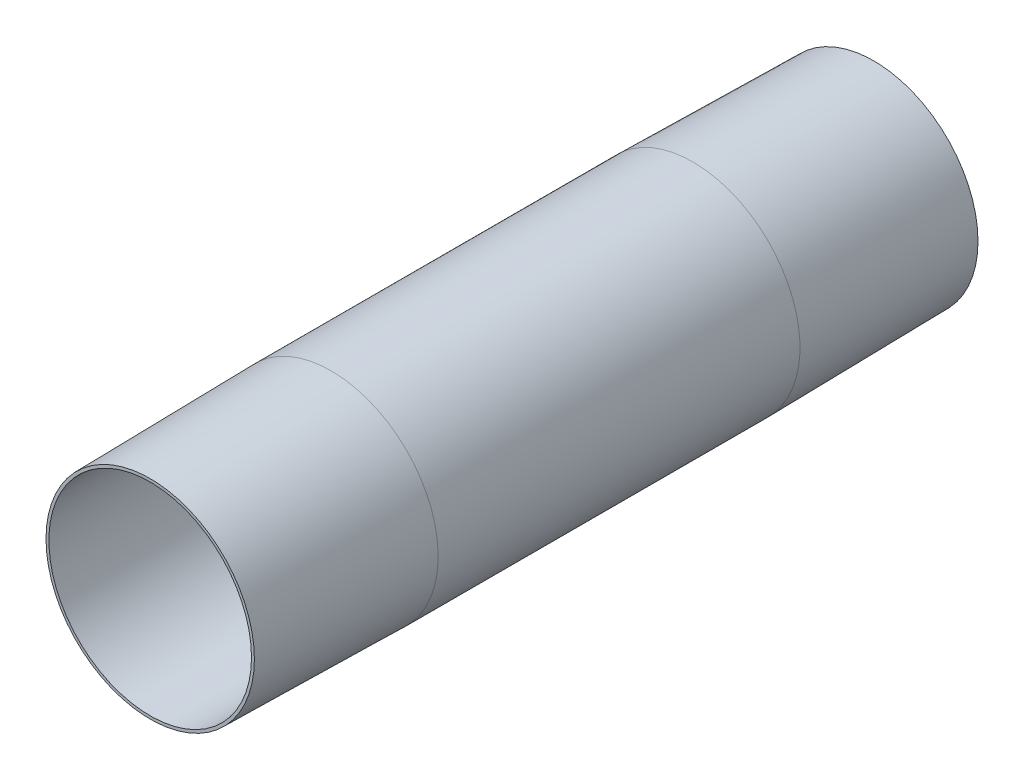
from build123d import *

# Parameters (mm, degrees)
IZIM1_R                     = 74
IZIM1_R_2                   = 70
Y_KSEKLIK_EKSTR_ZYON1_DEPTH = 500


with BuildPart() as part:
    # Çizim1 → Yükseklik-Ekstrüzyon1 (new body)
    with BuildSketch(Plane.XY):
        Circle(IZIM1_R)
        Circle(IZIM1_R_2, mode=Mode.SUBTRACT)
    extrude(amount=Y_KSEKLIK_EKSTR_ZYON1_DEPTH)

    # Çizim2 → Kes-Döndür1 (revolve, cut)
    with BuildSketch(Plane(origin=(0, 0, 0), x_dir=(1, 0, 0), z_dir=(0, 1, 0))):
        Polygon((-74, -500), (-72, -500), (-74, -375), align=None)
        Polygon((-74, -125), (-74, 0), (-72, 0), align=None)
    revolve(axis=Axis((0, 0, 0), (0, 0, 1)), mode=Mode.SUBTRACT)


solid = part.part
